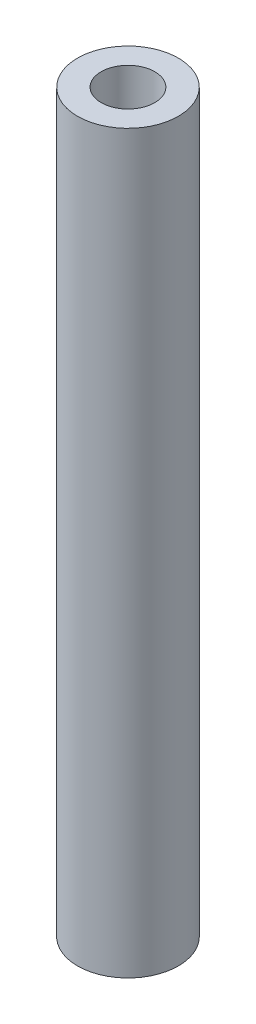
from build123d import *

# Parameters (mm, degrees)
SKETCH1_R           = 9.398
SKETCH1_R_2         = 5
BOSS_EXTRUDE1_DEPTH = 137.16


with BuildPart() as part:
    # Sketch1 → Boss-Extrude1 (new body)
    with BuildSketch(Plane(origin=(0, 0, 0), x_dir=(1, 0, 0), z_dir=(0, 1, 0))):
        with Locations(Location((0, 0, 0), (0, 0, 270))):
            Circle(SKETCH1_R)
        with Locations(Location((0, 0, 0), (0, 0, 270))):
            Circle(SKETCH1_R_2, mode=Mode.SUBTRACT)
    extrude(amount=BOSS_EXTRUDE1_DEPTH)


solid = part.part
